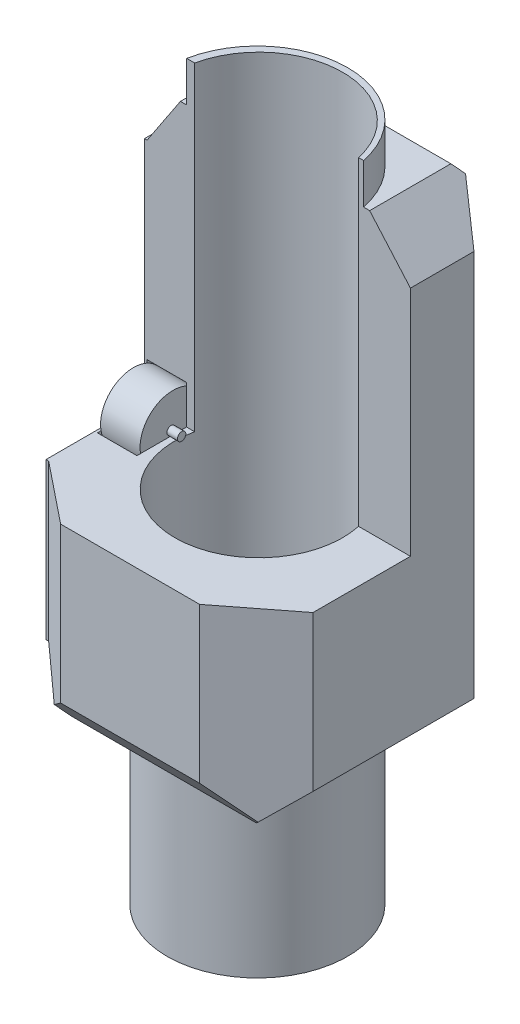
from build123d import *

# Parameters (mm, degrees)
SKETCH1_W           = 100
SKETCH1_H           = 100
BOSS_EXTRUDE1_DEPTH = 180
SKETCH2_R           = 34.257790197
BOSS_EXTRUDE2_DEPTH = 350
SKETCH3_W           = 152.006357392
SKETCH3_H           = 282.452416457
CUT_EXTRUDE2_DEPTH  = 400
CUT_EXTRUDE3_DEPTH  = 400
CUT_EXTRUDE4_DEPTH  = 400
CUT_EXTRUDE5_DEPTH  = 400
SKETCH7_W           = 160.159381639
SKETCH7_H           = 147.362276113
CUT_EXTRUDE6_DEPTH  = 400
SKETCH8_W           = 147.310744502
SKETCH8_H           = 162.038906966
CUT_EXTRUDE7_DEPTH  = 400
SKETCH9_R           = 31.847293423
CUT_EXTRUDE8_DEPTH  = 400
SKETCH10_W          = 140.220962397
SKETCH10_H          = 212.033531124
CUT_EXTRUDE9_DEPTH  = 400
SKETCH11_R          = 13.603137886
CUT_EXTRUDE11_DEPTH = 15
SKETCH12_R          = 12.495422516
BOSS_EXTRUDE3_DEPTH = 15
SKETCH13_R          = 1.594865099
BOSS_EXTRUDE4_DEPTH = 4
SKETCH14_W          = 100.74862993
SKETCH14_H          = 110.555003588
CUT_EXTRUDE13_DEPTH = 400
BOSS_EXTRUDE5_DEPTH = 1
SKETCH16_W          = 42.108585165
SKETCH16_H          = 30.458347221
BOSS_EXTRUDE6_DEPTH = 5
SKETCH17_W          = 18.669530869
SKETCH17_H          = 22.4027039
BOSS_EXTRUDE7_DEPTH = 1
SKETCH18_W          = 4.907623399
SKETCH18_H          = 5.170746831
SKETCH18_W_2        = 3.981473695
SKETCH18_H_2        = 5.451349552
BOSS_EXTRUDE8_DEPTH = 1
BOSS_EXTRUDE9_DEPTH = 1


with BuildPart() as part:
    # Sketch1 → Boss-Extrude1 (new body)
    with BuildSketch(Plane(origin=(0, 0, 0), x_dir=(1, 0, 0), z_dir=(0, 1, 0))):
        with Locations((-50, 50)):
            Rectangle(SKETCH1_W, SKETCH1_H)
    extrude(amount=BOSS_EXTRUDE1_DEPTH)

    # Sketch2 → Boss-Extrude2 (add, symmetric)
    with BuildSketch(Plane(origin=(0, 180, 0), x_dir=(1, 0, 0), z_dir=(0, 1, 0))):
        with Locations(Location((-51.377291833, 49.076536384, 0), (0, 0, 270))):
            Circle(SKETCH2_R)
    extrude(amount=BOSS_EXTRUDE2_DEPTH, both=True)

    # Sketch3 → Cut-Extrude2 (cut)
    with BuildSketch(Plane(origin=(0, 0, 0), x_dir=(0, 0, -1), z_dir=(1, 0, 0))):
        with Locations((57.419900112, 502.274302507)):
            Rectangle(SKETCH3_W, SKETCH3_H)
    extrude(amount=-CUT_EXTRUDE2_DEPTH, mode=Mode.SUBTRACT)

    # Sketch4 → Cut-Extrude3 (cut)
    with BuildSketch(Plane(origin=(0, 0, 0), x_dir=(0, 0, -1), z_dir=(1, 0, 0))):
        Polygon((12.981970869, 0), (-8.994244796, 25.828096003), (-18.564506014, -15.259465835), align=None)
        Polygon((85.072517936, -1.448103984), (109.237639161, 19.113145112), (115.920034239, -3.267382694), align=None)
        Polygon((12.981970869, 180), (-8.994244796, 148.537596011), (-15.418178585, 193.219274892), align=None)
        Polygon((85.072517936, 181.854312784), (103.841225373, 159.795920888), (106.132549481, 198.647393934), align=None)
    extrude(amount=-CUT_EXTRUDE3_DEPTH, mode=Mode.SUBTRACT)

    # Sketch5 → Cut-Extrude4 (cut)
    with BuildSketch(Plane.XY):
        Polygon((-85.623287335, 0), (-106.370377984, 21.426392531), (-122.288861874, 3.209259887), (-93.526345261, -19.884701759), align=None)
        Polygon((-15.694988751, 0), (0, 15.257385304), (12.122677088, 15.257385304), (10.563067769, -19.884701759), align=None)
        Polygon((-87.166490339, 180.248071029), (-106.370377984, 151.29108453), (-117.705469457, 200.501115102), align=None)
        Polygon((-15.694988751, 180.248071029), (7.833767065, 153.279557508), (0, 193.941208308), align=None)
    extrude(amount=-CUT_EXTRUDE4_DEPTH, mode=Mode.SUBTRACT)

    # Sketch6 → Cut-Extrude5 (cut)
    with BuildSketch(Plane(origin=(0, 180, 0), x_dir=(1, 0, 0), z_dir=(0, 1, 0))):
        Polygon((-112.386997555, 28.400400964), (-64.261264503, -10.212759359), (-84.406366528, -15.51192827), (-124.649689542, -15.51192827), align=None)
        Polygon((-97.065537028, 135.861756084), (-119.37552445, 77.792688888), (-118.043343626, 64.347606737), (-66.428694172, 110.575168787), align=None)
        Polygon((-24.69640689, -21.815840769), (11.092108798, -8.97361337), (17.428316417, 32.393768119), (-38.531576846, -11.139157378), align=None)
        Polygon((-17.445484601, 140.804394854), (35.417473102, 107.262520599), (9.305452855, 72.996438725), (-31.724385352, 103.625272537), align=None)
    extrude(amount=-CUT_EXTRUDE5_DEPTH, mode=Mode.SUBTRACT)

    # Sketch7 → Cut-Extrude6 (cut)
    with BuildSketch(Plane.XY):
        with Locations((-66.123258915, -136.36252694)):
            Rectangle(SKETCH7_W, SKETCH7_H)
    extrude(amount=-CUT_EXTRUDE6_DEPTH, mode=Mode.SUBTRACT)

    # Sketch8 → Cut-Extrude7 (cut)
    with BuildSketch(Plane.XY):
        with Locations((-53.541153336, 332.448287589)):
            Rectangle(SKETCH8_W, SKETCH8_H)
    extrude(amount=-CUT_EXTRUDE7_DEPTH, mode=Mode.SUBTRACT)

    # Sketch9 → Cut-Extrude8 (cut)
    with BuildSketch(Plane(origin=(0, 251.428834106, 0), x_dir=(1, 0, 0), z_dir=(0, 1, 0))):
        with Locations(Location((-50.808993157, 49.032036374, 0), (0, 0, 270))):
            Circle(SKETCH9_R)
    extrude(amount=-CUT_EXTRUDE8_DEPTH, mode=Mode.SUBTRACT)

    # Sketch10 → Cut-Extrude9 (cut)
    with BuildSketch(Plane.ZY.offset(100)):
        with Locations((14.299084536, 180.100625535)):
            Rectangle(SKETCH10_W, SKETCH10_H)
    extrude(amount=-CUT_EXTRUDE9_DEPTH, mode=Mode.SUBTRACT)

    # Sketch11 → Cut-Extrude11 (cut)
    with BuildSketch(Plane.ZY.offset(100)):
        with Locations((-50.413251954, 76.264646142)):
            Circle(SKETCH11_R)
    extrude(amount=-CUT_EXTRUDE11_DEPTH, mode=Mode.SUBTRACT)

    # Sketch12 → Boss-Extrude3 (add)
    with BuildSketch(Plane.ZY.offset(85)):
        with Locations(Location((-50.658800768, 76.222522328, 0), (0, 0, 114.353089558))):
            Circle(SKETCH12_R)
    extrude(amount=BOSS_EXTRUDE3_DEPTH)

    # Sketch13 → Boss-Extrude4 (add)
    with BuildSketch(Plane(origin=(-85, 0, 0), x_dir=(0, 0, -1), z_dir=(1, 0, 0))):
        with Locations(Location((49.945205578, 75.944780088, 0), (0, 0, 180))):
            Circle(SKETCH13_R)
    extrude(amount=BOSS_EXTRUDE4_DEPTH)

    # Sketch14 → Cut-Extrude13 (cut)
    with BuildSketch(Plane.ZY.offset(100)):
        with Locations((-65.350029467, 250.603414818)):
            Rectangle(SKETCH14_W, SKETCH14_H)
    extrude(amount=-CUT_EXTRUDE13_DEPTH, mode=Mode.SUBTRACT)

    # Sketch15 → Boss-Extrude5 (add)
    with BuildSketch(Plane.ZY.offset(100)):
        Polygon((-18.461827727, 14.847435435), (-80.507743362, 14.847435435), (-80.507743362, 160.896793159), (-55.811396663, 160.896793159), (-55.811396663, 74.083859973), (-18.461827727, 74.083859973), align=None)
    extrude(amount=BOSS_EXTRUDE5_DEPTH)

    # Sketch16 → Boss-Extrude6 (add)
    with BuildSketch(Plane.ZY.offset(101)):
        with Locations((-48.07732297, 45.136437142)):
            Rectangle(SKETCH16_W, SKETCH16_H)
    extrude(amount=BOSS_EXTRUDE6_DEPTH)

    # Sketch17 → Boss-Extrude7 (add)
    with BuildSketch(Plane.ZY.offset(101)):
        with Locations((-67.04663872, 130.409241603)):
            Rectangle(SKETCH17_W, SKETCH17_H)
    extrude(amount=BOSS_EXTRUDE7_DEPTH)

    # Sketch18 → Boss-Extrude8 (add)
    with BuildSketch(Plane.ZY.offset(102)):
        with Locations((-71.625108618, 130.213401885)):
            Rectangle(SKETCH18_W, SKETCH18_H)
        with Locations((-62.297675883, 129.867186512)):
            Rectangle(SKETCH18_W_2, SKETCH18_H_2)
    extrude(amount=BOSS_EXTRUDE8_DEPTH)

    # Sketch19 → Boss-Extrude9 (add)
    with BuildSketch(Plane.ZY.offset(102)):
        Polygon((-66.976455081, 134.868836652), (-73.7929295, 134.868836652), (-73.7929295, 134.108269479), (-74.571872104, 134.108269479), (-74.571872104, 140.512729543), (-73.7929295, 140.512729543), (-72.165965418, 140.512729543), (-72.233411796, 137.421948277), (-71.48458153, 137.421948277), (-71.410861795, 140.512729543), (-69.158339735, 140.504865112), (-69.158339735, 137.421948277), (-68.22174926, 137.421948277), (-68.22174926, 140.567922793), (-65.426885805, 140.567922793), (-65.515241968, 137.446210948), (-64.714122339, 137.446210948), (-64.714122339, 140.567922793), (-62.410871788, 140.567922793), (-62.410871788, 137.210126003), (-61.403493639, 137.210126003), (-61.403493639, 140.631129361), (-58.889974549, 140.631129361), (-58.889974549, 136.595539338), (-59.698319644, 136.595539338), (-59.698319644, 139.99489006), (-60.695848378, 139.984078324), (-60.695848378, 136.667717235), (-63.090112056, 136.667717235), (-63.090112056, 139.979723883), (-64.00479018, 139.979723883), (-64.00479018, 136.667717235), (-66.334605538, 136.667717235), (-66.334605538, 139.902697072), (-67.48995239, 139.902697072), (-67.48995239, 136.667717235), (-70.008746759, 136.667717235), (-70.008746759, 139.902697072), (-70.709698815, 139.902697072), (-70.783897489, 136.693128041), (-72.921241048, 136.693128041), (-72.921241048, 139.545601992), (-73.7929295, 139.545601992), (-73.7929295, 135.423339258), (-66.976455081, 135.49721976), align=None)
    extrude(amount=BOSS_EXTRUDE9_DEPTH)


solid = part.part
